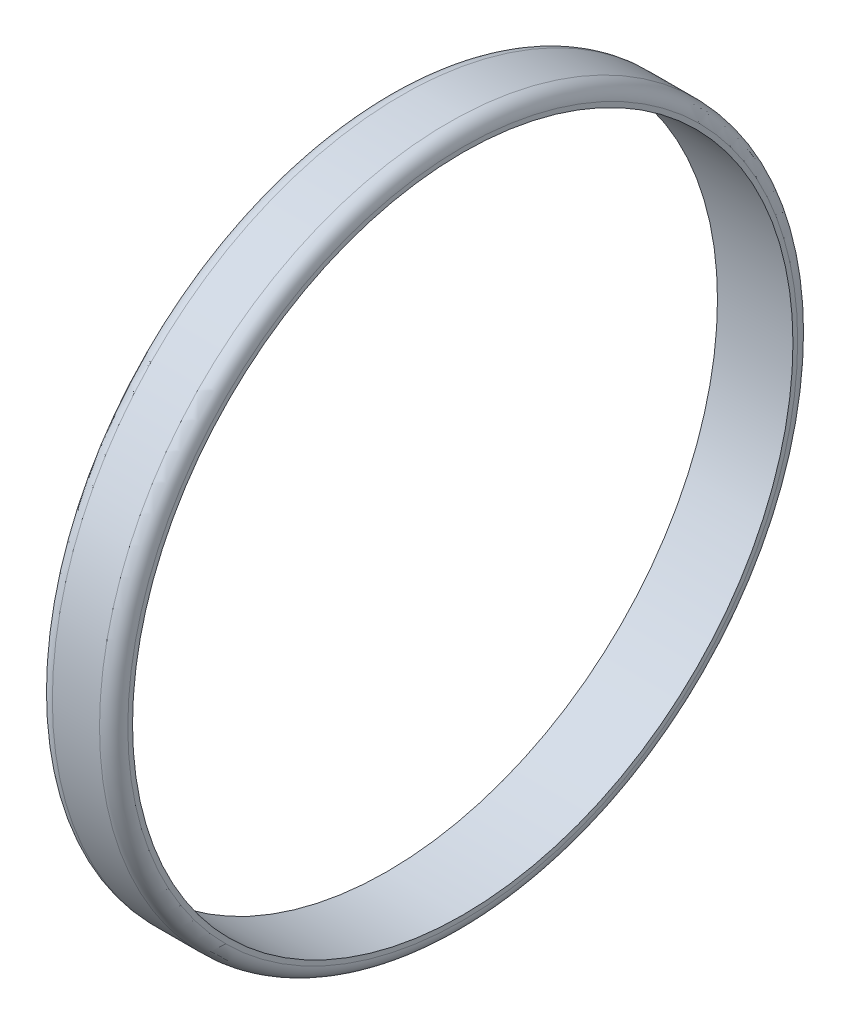
from build123d import *

# Parameters (mm, degrees)
SKETCH1_R           = 37
BOSS_EXTRUDE1_DEPTH = 8
FILLET1_R           = 1.5
SKETCH2_R           = 35
CUT_EXTRUDE1_DEPTH  = 53.933921141


with BuildPart() as part:
    # Sketch1 → Boss-Extrude1 (new body)
    with BuildSketch(Plane.YZ):
        with Locations(Location((0, 0, 0), (0, 0, 270))):
            Circle(SKETCH1_R)
    extrude(amount=BOSS_EXTRUDE1_DEPTH)

    # Fillet1
    fillet1_edges = [part.edges().sort_by_distance(p)[0] for p in [
        (0, 0, 37),
        (8, 0, 37),
    ]]
    fillet(fillet1_edges, radius=FILLET1_R)

    # Sketch2 → Cut-Extrude1 (cut, through all)
    with BuildSketch(Plane.YZ.offset(8)):
        with Locations(Location((0, 0, 0), (0, 0, 270))):
            Circle(SKETCH2_R)
    extrude(amount=-CUT_EXTRUDE1_DEPTH, mode=Mode.SUBTRACT)


solid = part.part
